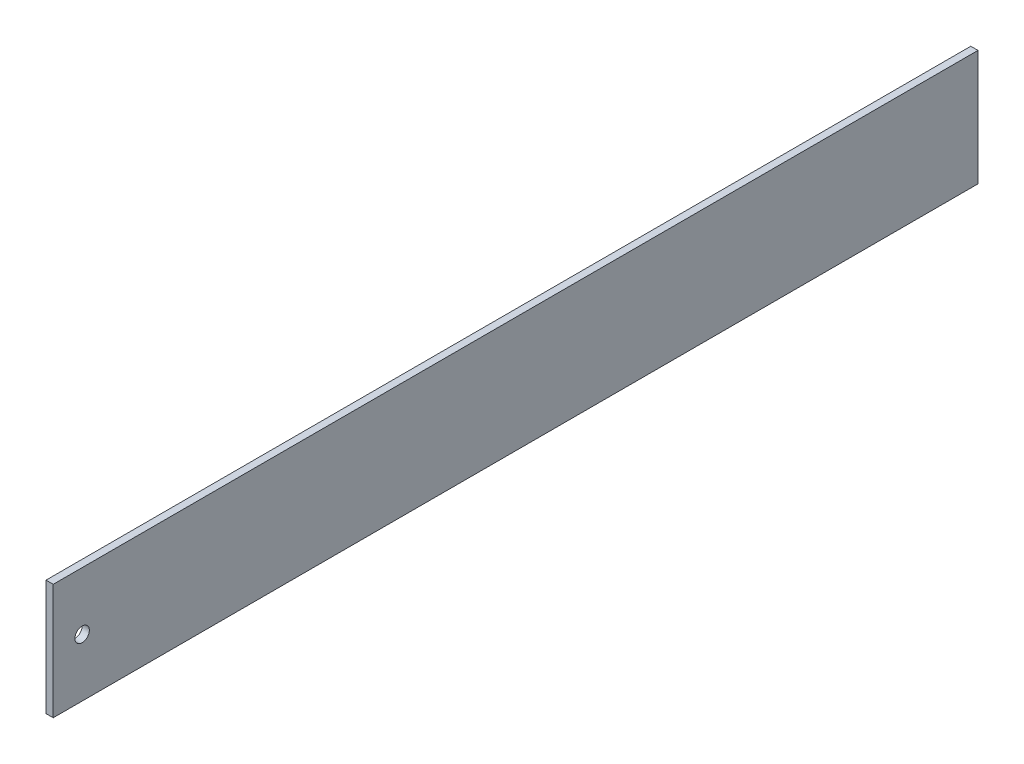
from build123d import *

# Parameters (mm, degrees)
SKETCH1_W           = 406.4
SKETCH1_H           = 50.8
BOSS_EXTRUDE1_DEPTH = 3.175
CUT_EXTRUDE1_REACH  = 206.806
SKETCH2_R           = 3.175


with BuildPart() as part:
    # Sketch1 → Boss-Extrude1 (new body)
    with BuildSketch(Plane(origin=(0, 0, 0), x_dir=(0, 0, -1), z_dir=(1, 0, 0))):
        Rectangle(SKETCH1_W, SKETCH1_H)
    extrude(amount=BOSS_EXTRUDE1_DEPTH)

    # Sketch2 → Cut-Extrude1 (cut, up to next)
    with BuildSketch(Plane(origin=(3.175, 0, 0), x_dir=(0, 0, -1), z_dir=(1, 0, 0)), mode=Mode.PRIVATE) as cut_extrude1_sk1:
        with Locations((-190.5, 0)):
            Circle(SKETCH2_R)
    cut_extrude1_tool1 = extrude(cut_extrude1_sk1.sketch, amount=-CUT_EXTRUDE1_REACH, mode=Mode.PRIVATE) & part.part
    add(cut_extrude1_tool1.solids().sort_by_distance((3.175, 0, 190.5))[0], mode=Mode.SUBTRACT)


solid = part.part
